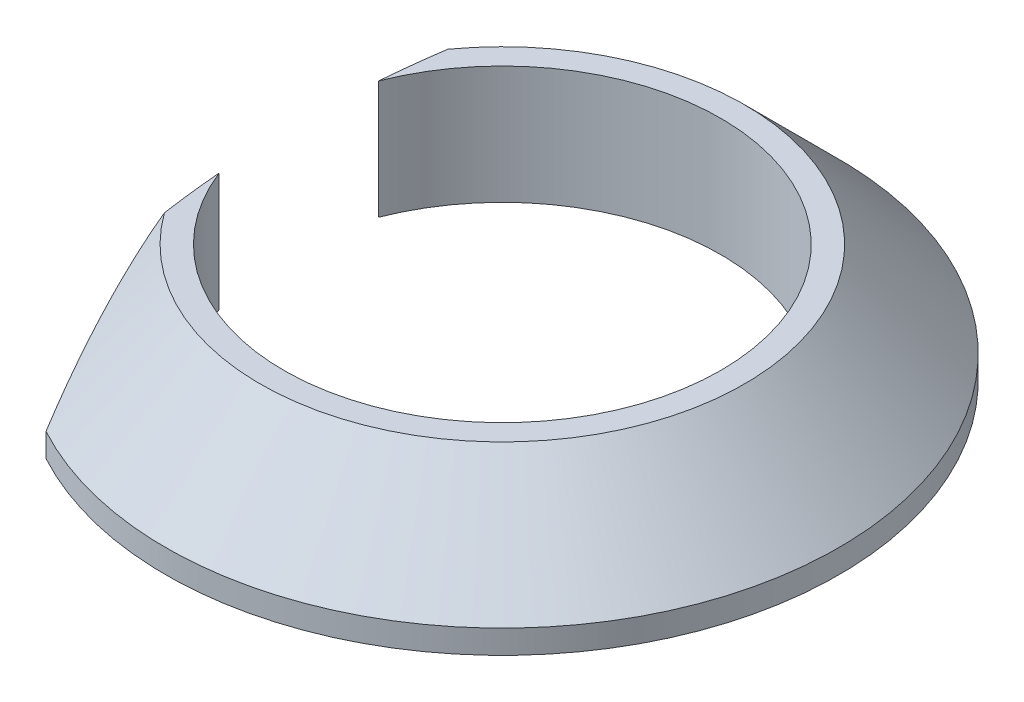
from build123d import *

# Parameters (mm, degrees)
SKETCH1_R               = 26.035
SKETCH1_R_2             = 23.495
BOSS_EXTRUDE1_DEPTH     = 12.7
CUT_EXTRUDE1_DEPTH      = 125.786790367
CUT_EXTRUDE1_DEPTH_BACK = 125.786790367


with BuildPart() as part:
    # Sketch1 → Boss-Extrude1 (new body)
    with BuildSketch(Plane(origin=(0, 0, 0), x_dir=(1, 0, 0), z_dir=(0, 1, 0))):
        with Locations(Location((-82.55, 0, 0), (0, 0, 270))):
            Circle(SKETCH1_R)
        with Locations(Location((-82.55, 0, 0), (0, 0, 270))):
            Circle(SKETCH1_R_2, mode=Mode.SUBTRACT)
    extrude(amount=BOSS_EXTRUDE1_DEPTH)

    # Sketch2 → Revolve1 (revolve)
    with BuildSketch(Plane(origin=(-82.55, 0, 0), x_dir=(0, -1, 0), z_dir=(-1, 0, 0)), mode=Mode.PRIVATE) as revolve1_sk:
        Polygon((0, -26.035), (0, -36.195), (-2.54, -36.195), (-12.7, -26.035), align=None)
    revolve(revolve1_sk.sketch.rotate(Axis((-82.55, 12.7, 0), (0, -1, 0)), 180), axis=Axis((-82.55, 12.7, 0), (0, -1, 0)))

    # Sketch3 → Cut-Extrude1 (cut, two sides: drawn at the far end of the back side and taken through both)
    with BuildSketch(Plane(origin=(0, 12.7, 0), x_dir=(1, 0, 0), z_dir=(0, 1, 0)).offset(-CUT_EXTRUDE1_DEPTH_BACK)):
        with BuildLine():
            ThreePointArc((-99.831769231, 31.802806122), (-104.775, 0), (-99.831769231, -31.802806122))
            ThreePointArc((-99.831769231, -31.802806122), (-118.745, 0), (-99.831769231, 31.802806122))
        make_face()
    extrude(amount=CUT_EXTRUDE1_DEPTH + CUT_EXTRUDE1_DEPTH_BACK, mode=Mode.SUBTRACT)


solid = part.part
